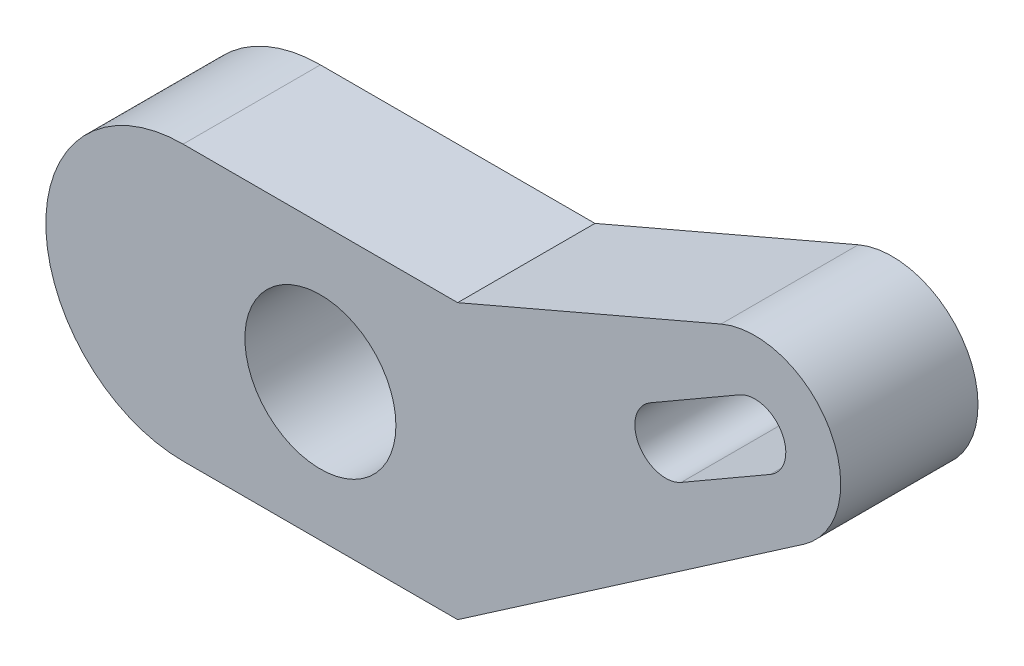
from build123d import *

# Parameters (mm, degrees)
EXTRUDE_1_DEPTH     = 20
SKETCH_2_R          = 12.5
EXTRUDE_2_DEPTH     = 20
SKETCH_3_R          = 4.5
SKETCH_3_R_2        = 11
CUT_EXTRUDE_1_DEPTH = 105.805216329


with BuildPart() as part:
    # Эскиз1 → Бобышка-Вытянуть1 (new body)
    with BuildSketch(Plane.XY):
        with BuildLine():
            Line((0, 20), (40, 20))
            Line((40, 20), (40, -20))
            Line((40, -20), (0, -20))
            ThreePointArc((0, -20), (-20, 0), (0, 20))
        make_face()
    extrude(amount=EXTRUDE_1_DEPTH)

    # Эскиз2 → Бобышка-Вытянуть2 (add)
    with BuildSketch(Plane.XY):
        with BuildLine():
            ThreePointArc((90.39137509, 14.705321156), (72.358344337, 18.958280561), (78.366684393, 36.484766564))
            Line((78.366684393, 36.484766564), (40, 20))
            Line((40, 20), (40, -20))
            Line((40, -20), (90.39137509, 14.705321156))
        make_face()
        with Locations((83.301270189, 25)):
            Circle(SKETCH_2_R)
    extrude(amount=EXTRUDE_2_DEPTH)

    # Эскиз3 → Вырез-Вытянуть1 (cut, through all)
    with BuildSketch(Plane.XY.offset(20)):
        with BuildLine():
            ThreePointArc((85.551270189, 21.102885683), (79.404155872, 22.75), (81.051270189, 28.897114317))
            Line((81.051270189, 28.897114317), (68.060889132, 21.397114317))
            ThreePointArc((68.060889132, 21.397114317), (72.560889132, 21.397114317), (74.810889132, 17.5))
            ThreePointArc((74.810889132, 17.5), (74.208003449, 15.25), (72.560889132, 13.602885683))
            Line((72.560889132, 13.602885683), (85.551270189, 21.102885683))
        make_face()
        with Locations((83.301270189, 25)):
            Circle(SKETCH_3_R)
        with Locations((20, 0)):
            Circle(SKETCH_3_R_2)
        with Locations((70.310889132, 17.5)):
            Circle(SKETCH_3_R)
    extrude(amount=-CUT_EXTRUDE_1_DEPTH, mode=Mode.SUBTRACT)


solid = part.part
